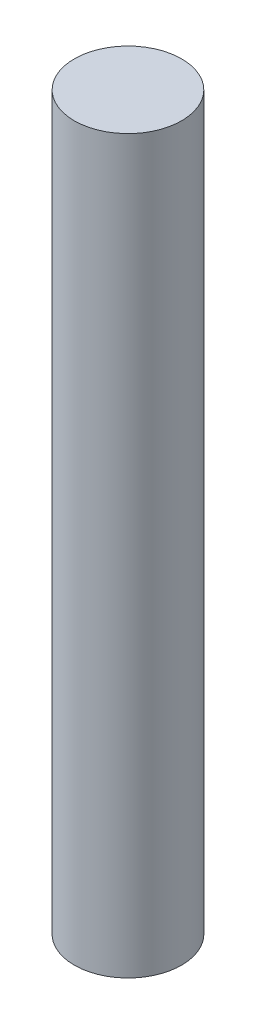
from build123d import *

# Parameters (mm, degrees)
SKETCH_1_R      = 35
EXTRUDE_1_DEPTH = 477


with BuildPart() as part:
    # 草图1 → 凸台-拉伸1 (new body)
    with BuildSketch(Plane(origin=(0, 0, 0), x_dir=(1, 0, 0), z_dir=(0, 1, 0))):
        with Locations(Location((0, 0, 0), (0, 0, 270))):
            Circle(SKETCH_1_R)
    extrude(amount=EXTRUDE_1_DEPTH)


solid = part.part
